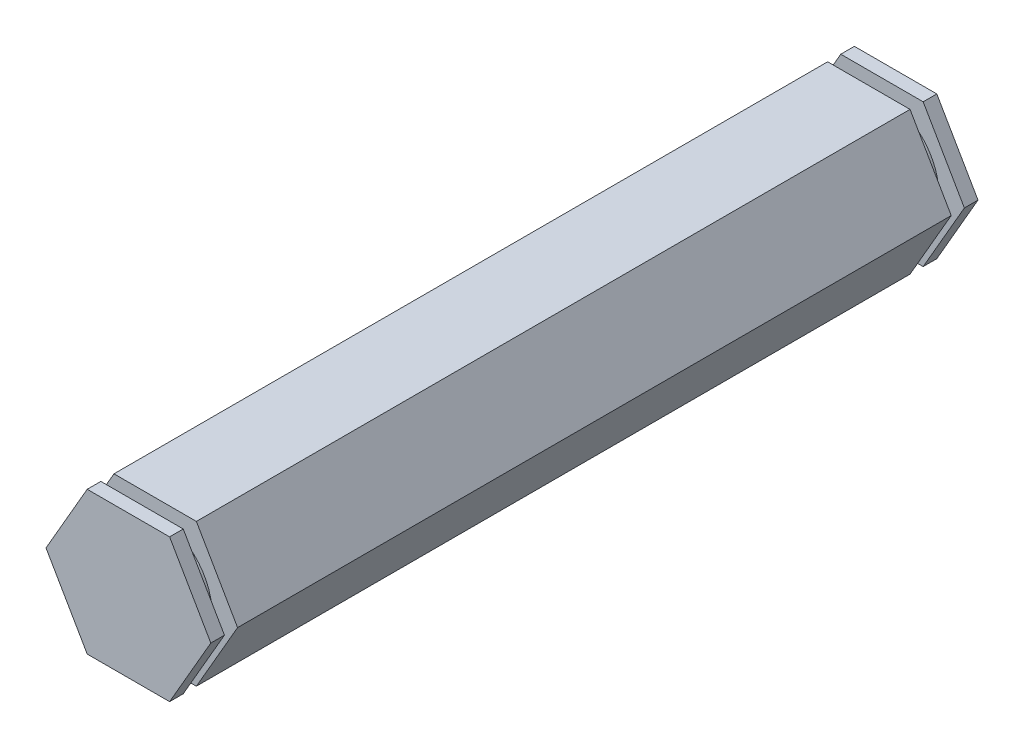
from build123d import *

# Parameters (mm, degrees)
BOSS_EXTRUDE1_DEPTH = 34.13125
SKETCH2_W           = 1.1684
SKETCH2_H           = 4.415483176


with BuildPart() as part:
    # Sketch1 → Boss-Extrude1 (new, symmetric)
    with BuildSketch(Plane.XY):
        Polygon((-3.666174209, 6.35), (-7.332348419, 0), (-3.666174209, -6.35), (3.666174209, -6.35), (7.332348419, 0), (3.666174209, 6.35), align=None)
    extrude(amount=BOSS_EXTRUDE1_DEPTH, both=True)

    # Sketch2 → Cut-Revolve1 (revolve, cut)
    with BuildSketch(Plane(origin=(0, 0, 0), x_dir=(0, 0, -1), z_dir=(1, 0, 0))):
        with Locations((-32.3342, 7.262341588)):
            Rectangle(SKETCH2_W, SKETCH2_H)
    cut_revolve1 = revolve(axis=Axis((0, 0, 0), (0, 0, 1)), mode=Mode.SUBTRACT)

    # Mirror1: Cut-Revolve1 across plane
    add(cut_revolve1.mirror(Plane.XY), mode=Mode.SUBTRACT)


solid = part.part
